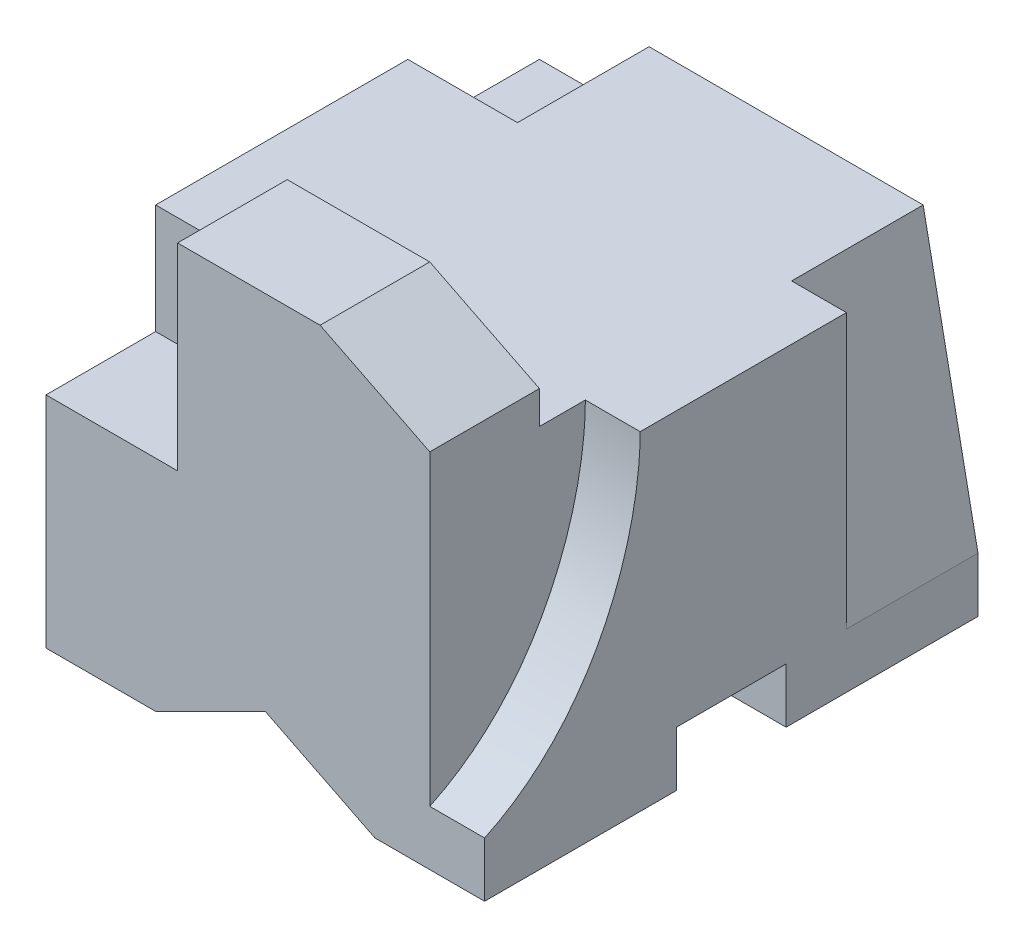
from build123d import *

# Parameters (mm, degrees)
SKETCH_1_W          = 45
SKETCH_1_H          = 30
EXTRUDE_1_DEPTH     = 40
SKETCH_2_W          = 10
SKETCH_2_H          = 3
SKETCH_2_H_2        = 2
CUT_EXTRUDE_1_DEPTH = 49.28301979
CUT_EXTRUDE_2_DEPTH = 5
CUT_EXTRUDE_3_DEPTH = 12
CUT_EXTRUDE_4_DEPTH = 63.048368391
SKETCH_6_W          = 5
SKETCH_6_H          = 10
CUT_EXTRUDE_5_DEPTH = 14.19009
EXTRUDE_2_DEPTH     = 10
SKETCH_8_W          = 12
SKETCH_8_H          = 6
CUT_EXTRUDE_6_DEPTH = 10
SKETCH_9_W          = 12
SKETCH_9_H          = 18
CUT_EXTRUDE_7_DEPTH = 10
EXTRUDE_START       = -1e-06
SKETCH_10_W         = 5
SKETCH_10_H         = 10
EXTRUDE_3_DEPTH     = 4.19009
EXTRUDE_4_DEPTH     = 10


with BuildPart() as part:
    # Эскиз1 → Бобышка-Вытянуть1 (new body)
    with BuildSketch(Plane(origin=(0, 0, 0), x_dir=(0, 0, -1), z_dir=(1, 0, 0))):
        Rectangle(SKETCH_1_W, SKETCH_1_H)
    extrude(amount=EXTRUDE_1_DEPTH)

    # Эскиз2 → Вырез-Вытянуть1 (cut, through all)
    with BuildSketch(Plane(origin=(40, 0, 0), x_dir=(0, 0, -1), z_dir=(1, 0, 0))):
        with Locations((0, -11.5)):
            Rectangle(SKETCH_2_W, SKETCH_2_H)
        with Locations((0, -14)):
            Rectangle(SKETCH_2_W, SKETCH_2_H_2)
    extrude(amount=-CUT_EXTRUDE_1_DEPTH, mode=Mode.SUBTRACT)

    # Эскиз3 → Вырез-Вытянуть2 (cut)
    with BuildSketch(Plane(origin=(40, 0, 0), x_dir=(0, 0, -1), z_dir=(1, 0, 0))):
        with BuildLine():
            Line((-22.5, 15), (-22.5, -10))
            add(Edge.make_bspline(
                [(-8.309911122, 15), (-8.309911122, 6.581189356), (-12.462330184, -5.292395359), (-22.5, -10)],
                knots=[0, 0, 0, 0, 1, 1, 1, 1], degree=3))
            Line((-8.309911122, 15), (-22.5, 15))
        make_face()
    extrude(amount=-CUT_EXTRUDE_2_DEPTH, mode=Mode.SUBTRACT)

    # Эскиз4 → Вырез-Вытянуть3 (cut)
    with BuildSketch(Plane(origin=(0, 0, -22.5), x_dir=(-1, 0, 0), z_dir=(0, 0, -1))):
        Polygon((-40, 15), (-35, 15), (-40, -10), align=None)
    extrude(amount=-CUT_EXTRUDE_3_DEPTH, mode=Mode.SUBTRACT)

    # Эскиз5 → Вырез-Вытянуть4 (cut, through all)
    with BuildSketch(Plane.XY.offset(22.5)):
        Polygon((20, -10), (30, -15), (10, -15), align=None)
    extrude(amount=-CUT_EXTRUDE_4_DEPTH, mode=Mode.SUBTRACT)

    # Эскиз6 → Вырез-Вытянуть5 (cut)
    with BuildSketch(Plane.XY.offset(22.5)):
        with Locations((2.5, 10)):
            Rectangle(SKETCH_6_W, SKETCH_6_H)
    extrude(amount=-CUT_EXTRUDE_5_DEPTH, mode=Mode.SUBTRACT)

    # Эскиз7 → Бобышка-Вытянуть2 (add)
    with BuildSketch(Plane.XY.offset(22.5)):
        Polygon((35, 15), (35, 18), (25, 23), (15, 23), (5, 18), (5, 15), align=None)
    extrude(amount=-EXTRUDE_2_DEPTH)

    # Эскиз8 → Вырез-Вытянуть6 (cut)
    with BuildSketch(Plane.ZY):
        with Locations((-16.5, 12)):
            Rectangle(SKETCH_8_W, SKETCH_8_H)
    extrude(amount=-CUT_EXTRUDE_6_DEPTH, mode=Mode.SUBTRACT)

    # Эскиз9 → Вырез-Вытянуть7 (cut)
    with BuildSketch(Plane.XY.offset(22.5)):
        with Locations((6, 14)):
            Rectangle(SKETCH_9_W, SKETCH_9_H)
    extrude(amount=-CUT_EXTRUDE_7_DEPTH, mode=Mode.SUBTRACT)

    # Эскиз10 → Бобышка-Вытянуть3 (add)
    with BuildSketch(Plane.XY.offset(8.309911122).offset(EXTRUDE_START)):
        with Locations((2.5, 10)):
            Rectangle(SKETCH_10_W, SKETCH_10_H)
    extrude(amount=EXTRUDE_3_DEPTH)

    # Эскиз11 → Бобышка-Вытянуть4 (add)
    with BuildSketch(Plane.XY.offset(22.5)):
        Polygon((15, 23), (12, 21.5), (12, 23), align=None)
    extrude(amount=-EXTRUDE_4_DEPTH)


solid = part.part
